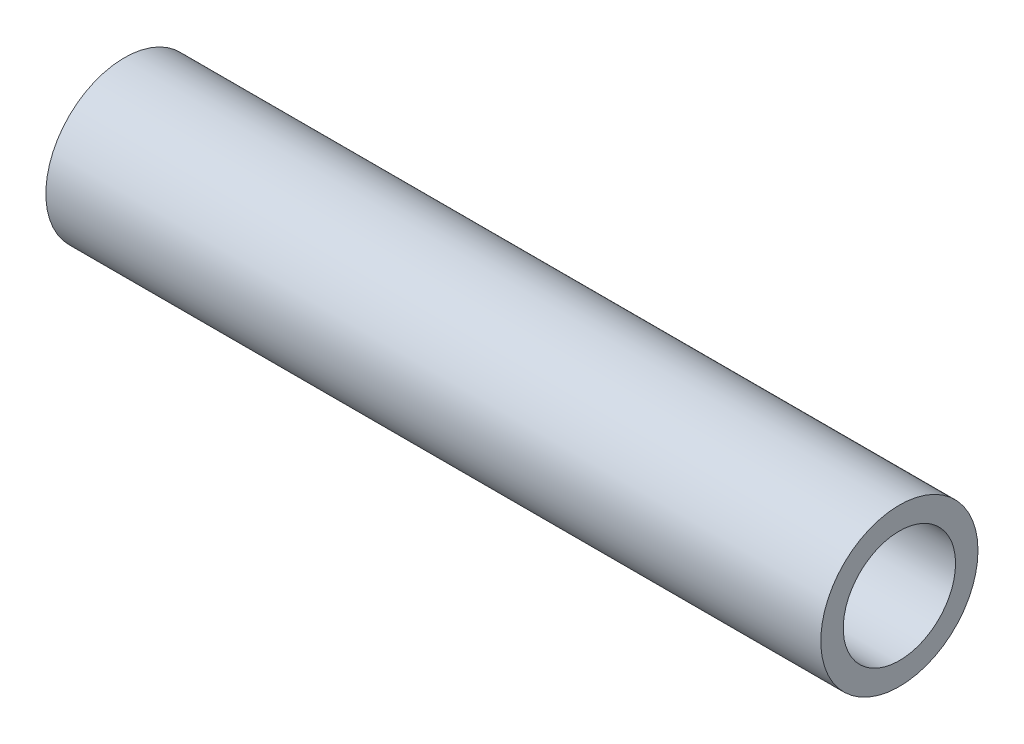
from build123d import *

# Parameters (mm, degrees)
SKETCH1_R           = 7
SKETCH1_R_2         = 5
BOSS_EXTRUDE1_DEPTH = 69


with BuildPart() as part:
    # Sketch1 → Boss-Extrude1 (new body)
    with BuildSketch(Plane.YZ):
        with Locations(Location((0, 0, 0), (0, 0, 270))):
            Circle(SKETCH1_R)
        with Locations(Location((0, 0, 0), (0, 0, 270))):
            Circle(SKETCH1_R_2, mode=Mode.SUBTRACT)
    extrude(amount=BOSS_EXTRUDE1_DEPTH)


solid = part.part
